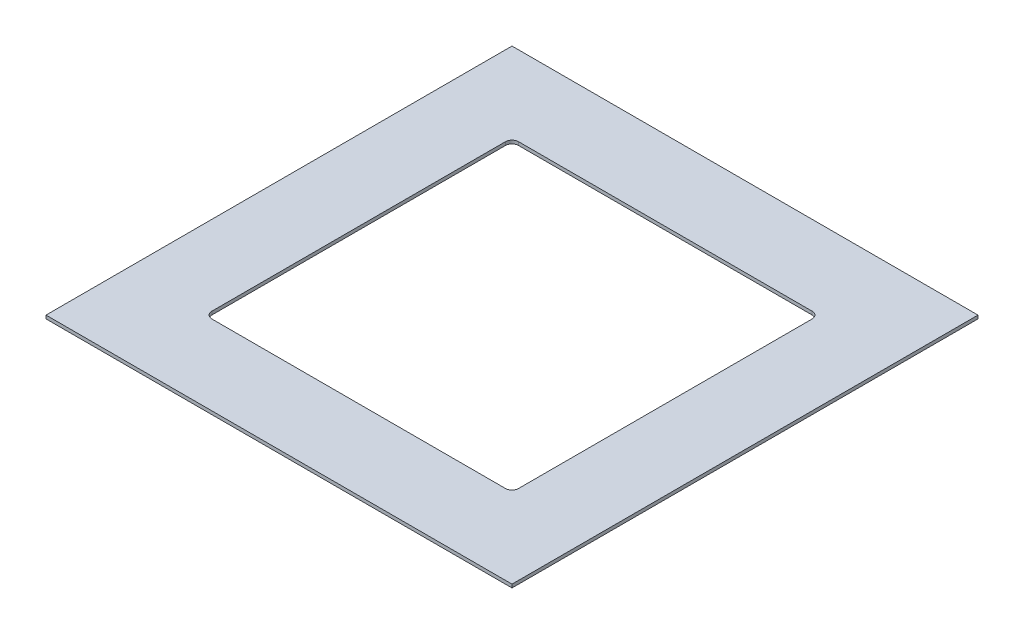
from build123d import *

# Parameters (mm, degrees)
SKETCH1_W           = 139.7
SKETCH1_H           = 139.7
SKETCH1_W_2         = 92
SKETCH1_H_2         = 92
BOSS_EXTRUDE1_DEPTH = 0.5
FILLET1_R           = 2


with BuildPart() as part:
    # Sketch1 → Boss-Extrude1 (new, symmetric)
    with BuildSketch(Plane(origin=(0, 0, 0), x_dir=(1, 0, 0), z_dir=(0, 1, 0))):
        Rectangle(SKETCH1_W, SKETCH1_H)
        Rectangle(SKETCH1_W_2, SKETCH1_H_2, mode=Mode.SUBTRACT)
    extrude(amount=BOSS_EXTRUDE1_DEPTH, both=True)

    # Fillet1
    fillet1_edges = [part.edges().sort_by_distance(p)[0] for p in [
        (46, 0, 46),
        (46, 0, -46),
        (-46, 0, -46),
        (-46, 0, 46),
    ]]
    fillet(fillet1_edges, radius=FILLET1_R)


solid = part.part
